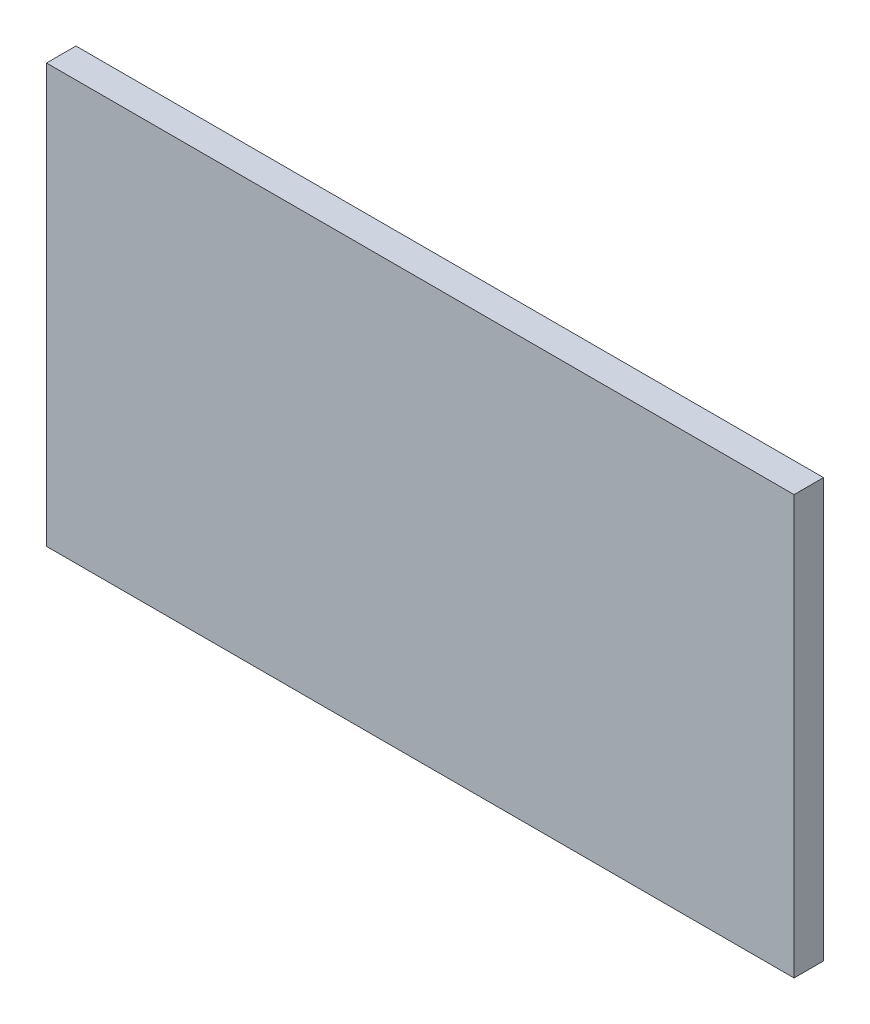
from build123d import *

# Parameters (mm, degrees)
CROQUIS1_W              = 50.8
CROQUIS1_H              = 28.448
SALIENTE_EXTRUIR1_DEPTH = 2


with BuildPart() as part:
    # Croquis1 → Saliente-Extruir1 (new body)
    with BuildSketch(Plane.XY):
        Rectangle(CROQUIS1_W, CROQUIS1_H)
    extrude(amount=SALIENTE_EXTRUIR1_DEPTH)


solid = part.part
